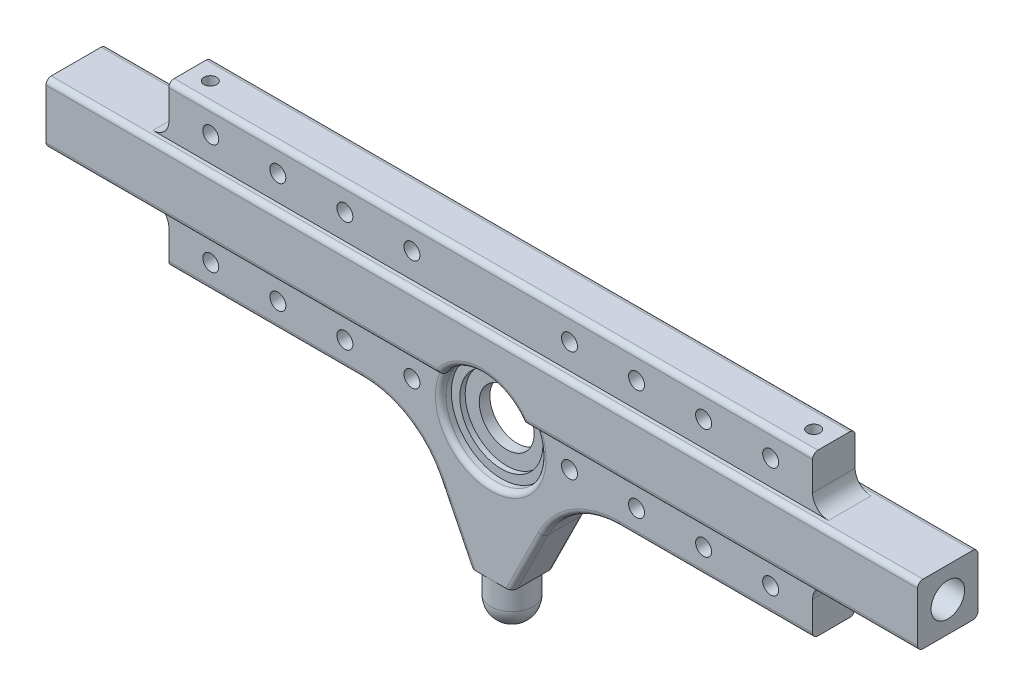
from build123d import *

# Parameters (mm, degrees)
SKETCH2_W           = 18
SKETCH2_H           = 18
BOSS_EXTRUDE2_DEPTH = 130
BOSS_EXTRUDE3_DEPTH = 6.35
SKETCH11_W          = 73.448818898
SKETCH11_H          = 15
SKETCH11_W_2        = 192
BOSS_EXTRUDE6_DEPTH = 12.7
SKETCH13_R          = 2.38125
CUT_EXTRUDE3_DEPTH  = 14.27
FILLET4_R           = 25.4
SKETCH6_R           = 5
CUT_EXTRUDE4_DEPTH  = 42
SKETCH14_R          = 3.96875
CUT_EXTRUDE5_DEPTH  = 22
SKETCH16_R          = 1.905
CUT_EXTRUDE7_DEPTH  = 139.87044322
FILLET7_R           = 1.5875
FILLET8_R           = 1.5875
FILLET15_R          = 4.7625


with BuildPart() as part:
    # Sketch2 → Boss-Extrude2 (new, symmetric)
    with BuildSketch(Plane(origin=(0, 0, 0), x_dir=(0, 0, -1), z_dir=(1, 0, 0))):
        with Locations((0, 9)):
            Rectangle(SKETCH2_W, SKETCH2_H)
    extrude(amount=BOSS_EXTRUDE2_DEPTH, both=True)

    # Sketch3 → Boss-Extrude3 (add, symmetric)
    with BuildSketch(Plane.XY):
        Polygon((-6.35, -47.625), (6.35, -47.625), (30, 0), (-30, 0), align=None)
    extrude(amount=BOSS_EXTRUDE3_DEPTH, both=True)

    # Sketch4 → Cut-Revolve1 (revolve, cut)
    with BuildSketch(Plane(origin=(0, -8.255, 0), x_dir=(-1, 0, 0), z_dir=(0, -1, 0))):
        Polygon((10.153399538, 1.5875), (11.6205, 1.5875), (12.3825, 1.5875), (12.3825, 1.778), (12.3825, 2.667), (12.3825, 3.175), (12.6365, 3.175), (14.1605, 3.175), (14.9225, 3.175), (14.9225, 3.683), (14.9225, 9.0424), (0, 9.0424), (0, -9.0424), (14.9225, -9.0424), (14.9225, -3.683), (14.9225, -3.175), (14.1605, -3.175), (12.6365, -3.175), (12.3825, -3.175), (12.3825, -2.667), (12.3825, -1.778), (12.3825, -1.5875), (11.6205, -1.5875), (10.153399538, -1.5875), (8.1915, -1.5875), (8.1915, 1.5875), align=None)
    revolve(axis=Axis((0, -8.255, -9.0424), (0, 0, 1)), mode=Mode.SUBTRACT)

    # Sketch11 → Boss-Extrude6 (add)
    with BuildSketch(Plane.XY.offset(6.35)):
        with Locations((-59.275590551, -7.5)):
            Rectangle(SKETCH11_W, SKETCH11_H)
        with Locations((0, 25.5)):
            Rectangle(SKETCH11_W_2, SKETCH11_H)
        with Locations((59.275590551, -7.5)):
            Rectangle(SKETCH11_W, SKETCH11_H)
    extrude(amount=-BOSS_EXTRUDE6_DEPTH)

    # Sketch12 → Revolve2 (revolve)
    with BuildSketch(Plane.XY):
        with BuildLine():
            Line((0, -47.625), (6.35, -47.625))
            Line((6.35, -47.625), (6.35, -54.61))
            ThreePointArc((6.35, -54.61), (4.490128061, -59.100128061), (0, -60.96))
            Line((0, -60.96), (0, -47.625))
        make_face()
    revolve(axis=Axis((0, -54.61, 0), (0, -1, 0)))

    # Sketch13 → Cut-Extrude3 (cut)
    with BuildSketch(Plane.XY.offset(6.35)):
        with Locations((63.5, 25.5)):
            Circle(SKETCH13_R)
        with Locations((43.5, 25.5)):
            Circle(SKETCH13_R)
        with Locations((23.5, 25.5)):
            Circle(SKETCH13_R)
        with Locations((-23.5, 25.5)):
            Circle(SKETCH13_R)
        with Locations((-43.5, 25.5)):
            Circle(SKETCH13_R)
        with Locations((-63.5, 25.5)):
            Circle(SKETCH13_R)
        with Locations((83.5, 25.5)):
            Circle(SKETCH13_R)
        with Locations((83.5, -7.5)):
            Circle(SKETCH13_R)
        with Locations((63.5, -7.5)):
            Circle(SKETCH13_R)
        with Locations((43.5, -7.5)):
            Circle(SKETCH13_R)
        with Locations((23.5, -7.5)):
            Circle(SKETCH13_R)
        with Locations((-83.5, -7.5)):
            Circle(SKETCH13_R)
        with Locations((-63.5, -7.5)):
            Circle(SKETCH13_R)
        with Locations((-43.5, -7.5)):
            Circle(SKETCH13_R)
        with Locations((-23.5, -7.5)):
            Circle(SKETCH13_R)
        with Locations((-83.5, 25.5)):
            Circle(SKETCH13_R)
    extrude(amount=-CUT_EXTRUDE3_DEPTH, mode=Mode.SUBTRACT)

    # Fillet4
    fillet4_edges = [part.edges().sort_by_distance(p)[0] for p in [
        (22.551181102, -15, 0),
        (-22.551181102, -15, 0),
    ]]
    fillet(fillet4_edges, radius=FILLET4_R)

    # Sketch6 → Cut-Extrude4 (cut)
    with BuildSketch(Plane(origin=(130, 0, 0), x_dir=(0, 0, -1), z_dir=(1, 0, 0))):
        with Locations((0, 9)):
            Circle(SKETCH6_R)
    cut_extrude4 = extrude(amount=-CUT_EXTRUDE4_DEPTH, mode=Mode.SUBTRACT)

    # Sketch14 → Cut-Extrude5 (cut)
    with BuildSketch(Plane(origin=(88, 0, 0), x_dir=(0, 0, -1), z_dir=(1, 0, 0))):
        with Locations((0, 9)):
            Circle(SKETCH14_R)
    cut_extrude5 = extrude(amount=-CUT_EXTRUDE5_DEPTH, mode=Mode.SUBTRACT)

    # Sketch16 → Cut-Extrude7 (cut, through all)
    with BuildSketch(Plane.XZ.offset(15)):
        with Locations((90, 0)):
            Circle(SKETCH16_R)
    cut_extrude7 = extrude(amount=-CUT_EXTRUDE7_DEPTH, mode=Mode.SUBTRACT)

    # Fillet7
    fillet7_edges = [part.edges().sort_by_distance(p)[0] for p in [
        (10.948921831, -38.363957625, -6.35),
        (10.948921831, -38.363957625, 6.35),
        (-10.948921831, -38.363957625, 6.35),
        (-10.948921831, -38.363957625, -6.35),
        (-24.914171289, -18.811739849, 6.35),
        (-24.914171289, -18.811739849, -6.35),
        (24.914171289, -18.811739849, 6.35),
        (24.914171289, -18.811739849, -6.35),
        (-67.148629257, -15, 6.35),
        (67.148629257, -15, -6.35),
        (0, 33, -6.35),
        (67.148629257, -15, 6.35),
        (-67.148629257, -15, -6.35),
        (0, 33, 6.35),
    ]]
    fillet(fillet7_edges, radius=FILLET7_R)

    # Fillet8
    fillet8_edges = [part.edges().sort_by_distance(p)[0] for p in [
        (4.311361462, -22.541118038, -6.35),
        (4.311361462, -22.541118038, 6.35),
        (-71.215625094, 0, -9),
        (-71.215625094, 0, 9),
        (0, 6.6675, 9),
        (0, 6.6675, -9),
        (0, 18, 9),
        (0, 18, -9),
        (71.215625094, 0, -9),
        (71.215625094, 0, 9),
    ]]
    fillet(fillet8_edges, radius=FILLET8_R)

    # Mirror1: Cut-Extrude4, Cut-Extrude5, Cut-Extrude7 across plane
    add(cut_extrude4.mirror(Plane(origin=(0, 0, 0), x_dir=(0, 0, 1), z_dir=(1, 0, 0))), mode=Mode.SUBTRACT)
    add(cut_extrude5.mirror(Plane(origin=(0, 0, 0), x_dir=(0, 0, 1), z_dir=(1, 0, 0))), mode=Mode.SUBTRACT)
    add(cut_extrude7.mirror(Plane(origin=(0, 0, 0), x_dir=(0, 0, 1), z_dir=(1, 0, 0))), mode=Mode.SUBTRACT)

    # Fillet15
    fillet15_edges = [part.edges().sort_by_distance(p)[0] for p in [
        (96, 18, 0),
        (-96, 18, 0),
        (-96, 0, 0),
        (96, 0, 0),
    ]]
    fillet(fillet15_edges, radius=FILLET15_R)


solid = part.part
